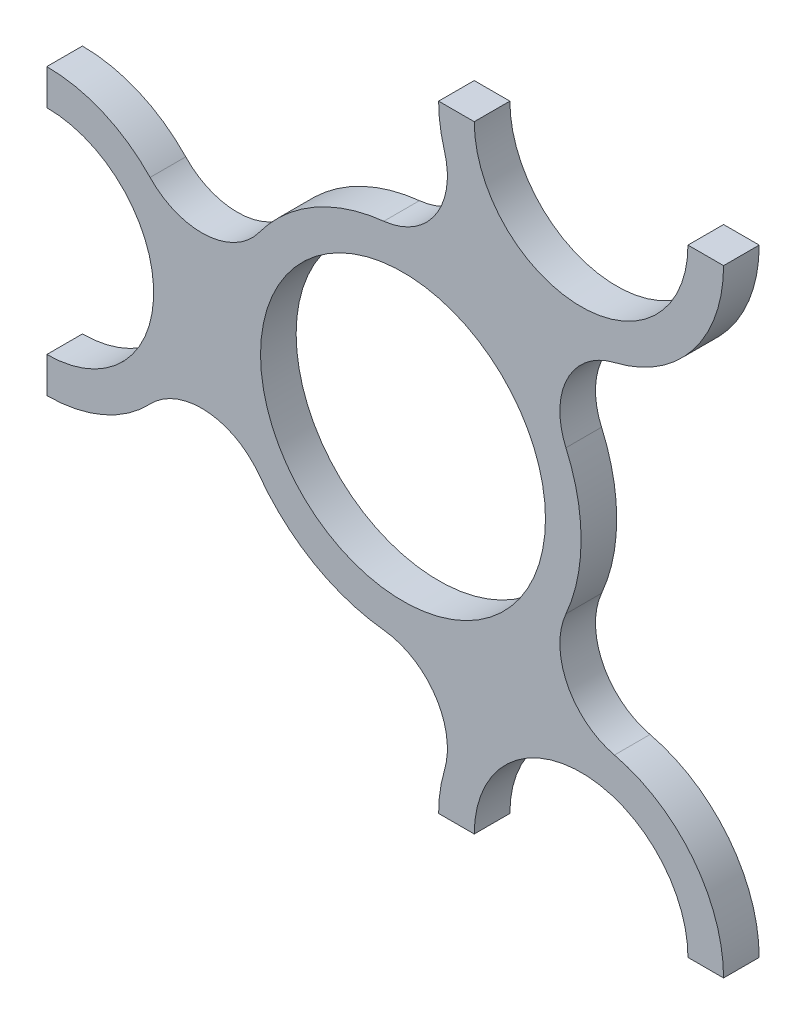
from build123d import *

# Parameters (mm, degrees)
SKETCH1_R           = 40
BOSS_EXTRUDE1_DEPTH = 10


with BuildPart() as part:
    # Sketch1 → Boss-Extrude1 (new body)
    with BuildSketch(Plane.XY):
        with BuildLine():
            Line((-42.649519898, 86.6), (-32.649519898, 86.6))
            ThreePointArc((-32.649519898, 86.6), (-2.649519898, 56.6), (27.350480102, 86.6))
            Line((27.350480102, 86.6), (37.350480102, 86.6))
            ThreePointArc((37.350480102, 86.6), (28.770103379, 61.845055583), (6.710116446, 47.710448608))
            ThreePointArc((6.710116446, 47.710448608), (-6.535755934, 37.135262428), (-6.907052386, 20.189766365))
            ThreePointArc((-6.907052386, 20.189766365), (-2.649519898, 0), (-6.907052386, -20.189766365))
            ThreePointArc((-6.907052386, -20.189766365), (-6.535755934, -37.135262428), (6.710116446, -47.710448608))
            ThreePointArc((6.710116446, -47.710448608), (28.770103379, -61.845055583), (37.350480102, -86.6))
            Line((37.350480102, -86.6), (27.350480102, -86.6))
            ThreePointArc((27.350480102, -86.6), (-2.649519898, -56.6), (-32.649519898, -86.6))
            Line((-32.649519898, -86.6), (-42.649519898, -86.6))
            ThreePointArc((-42.649519898, -86.6), (-42.237256805, -80.871903754), (-41.008965568, -75.261881641))
            ThreePointArc((-41.008965568, -75.261881641), (-43.544835006, -58.503090991), (-58.034640259, -49.709158902))
            ThreePointArc((-58.034640259, -49.709158902), (-77.649746268, -43.301139494), (-93.006662756, -29.51780853))
            ThreePointArc((-93.006662756, -29.51780853), (-107.86778001, -21.366045629), (-123.649519898, -27.549954628))
            ThreePointArc((-123.649519898, -27.549954628), (-136.869757307, -36.755939555), (-152.649519898, -40))
            Line((-152.649519898, -40), (-152.649519898, -30))
            ThreePointArc((-152.649519898, -30), (-122.649519898, 0), (-152.649519898, 30))
            Line((-152.649519898, 30), (-152.649519898, 40))
            ThreePointArc((-152.649519898, 40), (-136.869757307, 36.755939555), (-123.649519898, 27.549954628))
            ThreePointArc((-123.649519898, 27.549954628), (-107.86778001, 21.366045629), (-93.006662756, 29.51780853))
            ThreePointArc((-93.006662756, 29.51780853), (-77.649746268, 43.301139494), (-58.034640259, 49.709158902))
            ThreePointArc((-58.034640259, 49.709158902), (-43.544835006, 58.503090991), (-41.008965568, 75.261881641))
            ThreePointArc((-41.008965568, 75.261881641), (-42.237256805, 80.871903754), (-42.649519898, 86.6))
        make_face()
        with Locations((-52.649519898, 0)):
            Circle(SKETCH1_R, mode=Mode.SUBTRACT)
    extrude(amount=BOSS_EXTRUDE1_DEPTH)


solid = part.part
